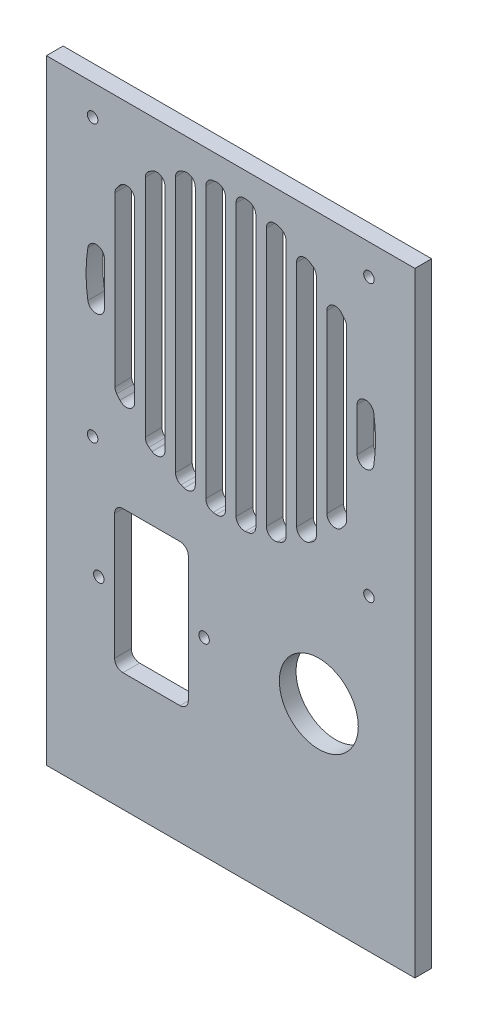
from build123d import *

# Parameters (mm, degrees)
SKETCH1_W           = 140
SKETCH1_H           = 233.5
BOSS_EXTRUDE1_DEPTH = 6.35
SKETCH2_R           = 2
SKETCH2_W           = 28
SKETCH2_H           = 54
CUT_EXTRUDE1_DEPTH  = 137.275034397
FILLET1_R           = 3.175
SKETCH3_R           = 15
CUT_EXTRUDE2_DEPTH  = 137.275034397
SKETCH4_R           = 2
CUT_EXTRUDE3_DEPTH  = 137.275034397
CUT_EXTRUDE4_DEPTH  = 6.35
FILLET2_R           = 3.175


with BuildPart() as part:
    # Sketch1 → Boss-Extrude1 (new body)
    with BuildSketch(Plane.XY):
        Rectangle(SKETCH1_W, SKETCH1_H)
    extrude(amount=BOSS_EXTRUDE1_DEPTH)

    # Sketch2 → Cut-Extrude1 (cut, through all)
    with BuildSketch(Plane.XY.offset(6.35)):
        with Locations((-50.09306053, -44.75)):
            Circle(SKETCH2_R)
        with Locations(Location((-10.09306053, -44.75, 0), (0, 0, 180))):
            Circle(SKETCH2_R)
        with Locations((-30.09306053, -44.75)):
            Rectangle(SKETCH2_W, SKETCH2_H)
    extrude(amount=-CUT_EXTRUDE1_DEPTH, mode=Mode.SUBTRACT)

    # Fillet1
    fillet1_edges = [part.edges().sort_by_distance(p)[0] for p in [
        (-16.09306053, -17.75, 3.175),
        (-16.09306053, -71.75, 3.175),
        (-44.09306053, -71.75, 3.175),
        (-44.09306053, -17.75, 3.175),
    ]]
    fillet(fillet1_edges, radius=FILLET1_R)

    # Sketch3 → Cut-Extrude2 (cut, through all)
    with BuildSketch(Plane.XY.offset(6.35)):
        with Locations((33.497744664, -44.75)):
            Circle(SKETCH3_R)
    extrude(amount=-CUT_EXTRUDE2_DEPTH, mode=Mode.SUBTRACT)

    # Sketch4 → Cut-Extrude3 (cut, through all)
    with BuildSketch(Plane.XY.offset(6.35)):
        with Locations((-52.445599483, 105.234409499)):
            Circle(SKETCH4_R)
        with Locations((52.554400517, 105.234409499)):
            Circle(SKETCH4_R)
        with Locations((52.554400517, 0.234409499)):
            Circle(SKETCH4_R)
        with Locations((-52.445599483, 0.234409499)):
            Circle(SKETCH4_R)
    extrude(amount=-CUT_EXTRUDE3_DEPTH, mode=Mode.SUBTRACT)

    # Sketch5 → Cut-Extrude4 (cut)
    with BuildSketch(Plane.XY.offset(6.35)):
        with BuildLine():
            Line((-47.945599483, 25.882966335), (-47.945599483, 79.585852663))
            ThreePointArc((-47.945599483, 79.585852663), (-54.945599483, 52.734409499), (-47.945599483, 25.882966335))
        make_face()
        with BuildLine():
            Line((-36.445599483, 11.591366345), (-36.445599483, 93.877452653))
            ThreePointArc((-36.445599483, 93.877452653), (-40.401004412, 89.995115505), (-43.945599483, 85.734409499))
            Line((-43.945599483, 85.734409499), (-43.945599483, 19.734409499))
            ThreePointArc((-43.945599483, 19.734409499), (-40.401004412, 15.473703493), (-36.445599483, 11.591366345))
        make_face()
        with BuildLine():
            Line((-24.945599483, 3.744614643), (-24.945599483, 101.724204355))
            ThreePointArc((-24.945599483, 101.724204355), (-28.788219753, 99.56498985), (-32.445599483, 97.105007872))
            Line((-32.445599483, 97.105007872), (-32.445599483, 8.363811126))
            ThreePointArc((-32.445599483, 8.363811126), (-28.788219753, 5.903829149), (-24.945599483, 3.744614643))
        make_face()
        with BuildLine():
            Line((-13.445599483, -0.583036051), (-13.445599483, 106.051855049))
            ThreePointArc((-13.445599483, 106.051855049), (-17.240267527, 104.944508687), (-20.945599483, 103.567469608))
            Line((-20.945599483, 103.567469608), (-20.945599483, 1.90134939))
            ThreePointArc((-20.945599483, 1.90134939), (-17.240267527, 0.524310311), (-13.445599483, -0.583036051))
        make_face()
        with BuildLine():
            Line((-1.945599483, -2.229214836), (-1.945599483, 107.698033834))
            ThreePointArc((-1.945599483, 107.698033834), (-5.709160893, 107.431588219), (-9.445599483, 106.907742422))
            Line((-9.445599483, 106.907742422), (-9.445599483, -1.438923424))
            ThreePointArc((-9.445599483, -1.438923424), (-5.709160893, -1.96276922), (-1.945599483, -2.229214836))
        make_face()
        with BuildLine():
            Line((9.554400517, -1.438923424), (9.554400517, 106.907742422))
            ThreePointArc((9.554400517, 106.907742422), (5.817961927, 107.431588219), (2.054400517, 107.698033834))
            Line((2.054400517, 107.698033834), (2.054400517, -2.229214836))
            ThreePointArc((2.054400517, -2.229214836), (5.817961927, -1.96276922), (9.554400517, -1.438923424))
        make_face()
        with BuildLine():
            ThreePointArc((21.054400517, 103.567469608), (17.349068561, 104.944508687), (13.554400517, 106.051855049))
            Line((13.554400517, 106.051855049), (13.554400517, -0.583036051))
            ThreePointArc((13.554400517, -0.583036051), (17.349068561, 0.524310311), (21.054400517, 1.90134939))
            Line((21.054400517, 1.90134939), (21.054400517, 103.567469608))
        make_face()
        with BuildLine():
            ThreePointArc((32.554400517, 97.105007872), (28.897020787, 99.56498985), (25.054400517, 101.724204355))
            Line((25.054400517, 101.724204355), (25.054400517, 3.744614643))
            ThreePointArc((25.054400517, 3.744614643), (28.897020787, 5.903829149), (32.554400517, 8.363811126))
            Line((32.554400517, 8.363811126), (32.554400517, 97.105007872))
        make_face()
        with BuildLine():
            ThreePointArc((44.054400517, 85.734409499), (40.509805446, 89.995115505), (36.554400517, 93.877452653))
            Line((36.554400517, 93.877452653), (36.554400517, 11.591366345))
            ThreePointArc((36.554400517, 11.591366345), (40.509805446, 15.473703493), (44.054400517, 19.734409499))
            Line((44.054400517, 19.734409499), (44.054400517, 85.734409499))
        make_face()
        with BuildLine():
            ThreePointArc((55.054400517, 52.734409499), (53.27563688, 66.608846425), (48.054400517, 79.585852663))
            Line((48.054400517, 79.585852663), (48.054400517, 25.882966335))
            ThreePointArc((48.054400517, 25.882966335), (53.27563688, 38.859972574), (55.054400517, 52.734409499))
        make_face()
    extrude(amount=-CUT_EXTRUDE4_DEPTH, mode=Mode.SUBTRACT)

    # Fillet2
    fillet2_edges = [part.edges().sort_by_distance(p)[0] for p in [
        (-47.945599483, 79.585852663, 3.175),
        (-47.945599483, 25.882966335, 3.175),
        (-36.445599483, 93.877452653, 3.175),
        (-36.445599483, 11.591366345, 3.175),
        (-43.945599483, 19.734409499, 3.175),
        (-43.945599483, 85.734409499, 3.175),
        (-24.945599483, 101.724204355, 3.175),
        (-24.945599483, 3.744614643, 3.175),
        (-32.445599483, 8.363811126, 3.175),
        (-32.445599483, 97.105007872, 3.175),
        (-13.445599483, 106.051855049, 3.175),
        (-13.445599483, -0.583036051, 3.175),
        (-20.945599483, 1.90134939, 3.175),
        (-20.945599483, 103.567469608, 3.175),
        (-1.945599483, 107.698033834, 3.175),
        (-1.945599483, -2.229214836, 3.175),
        (-9.445599483, -1.438923424, 3.175),
        (-9.445599483, 106.907742422, 3.175),
        (9.554400517, 106.907742422, 3.175),
        (9.554400517, -1.438923424, 3.175),
        (2.054400517, -2.229214836, 3.175),
        (2.054400517, 107.698033834, 3.175),
        (21.054400517, 103.567469608, 3.175),
        (21.054400517, 1.90134939, 3.175),
        (13.554400517, -0.583036051, 3.175),
        (13.554400517, 106.051855049, 3.175),
        (32.554400517, 97.105007872, 3.175),
        (32.554400517, 8.363811126, 3.175),
        (25.054400517, 3.744614643, 3.175),
        (25.054400517, 101.724204355, 3.175),
        (44.054400517, 85.734409499, 3.175),
        (44.054400517, 19.734409499, 3.175),
        (36.554400517, 11.591366345, 3.175),
        (36.554400517, 93.877452653, 3.175),
        (48.054400517, 25.882966335, 3.175),
        (48.054400517, 79.585852663, 3.175),
    ]]
    fillet(fillet2_edges, radius=FILLET2_R)


solid = part.part
